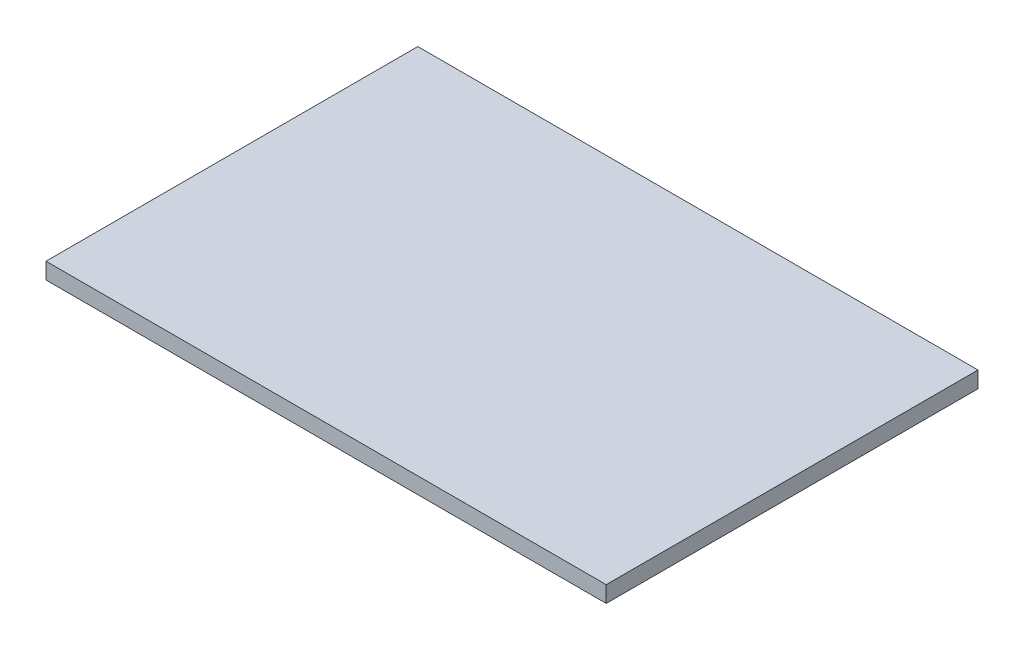
from build123d import *

# Parameters (mm, degrees)
SZKIC1_W                    = 550
SZKIC1_H                    = 365
DODANIE_WYCI_GNI_CIE1_DEPTH = 16


with BuildPart() as part:
    # Szkic1 → Dodanie-wyciągnięcie1 (new body)
    with BuildSketch(Plane(origin=(0, 0, 0), x_dir=(1, 0, 0), z_dir=(0, 1, 0))):
        Rectangle(SZKIC1_W, SZKIC1_H)
    extrude(amount=DODANIE_WYCI_GNI_CIE1_DEPTH)


solid = part.part
